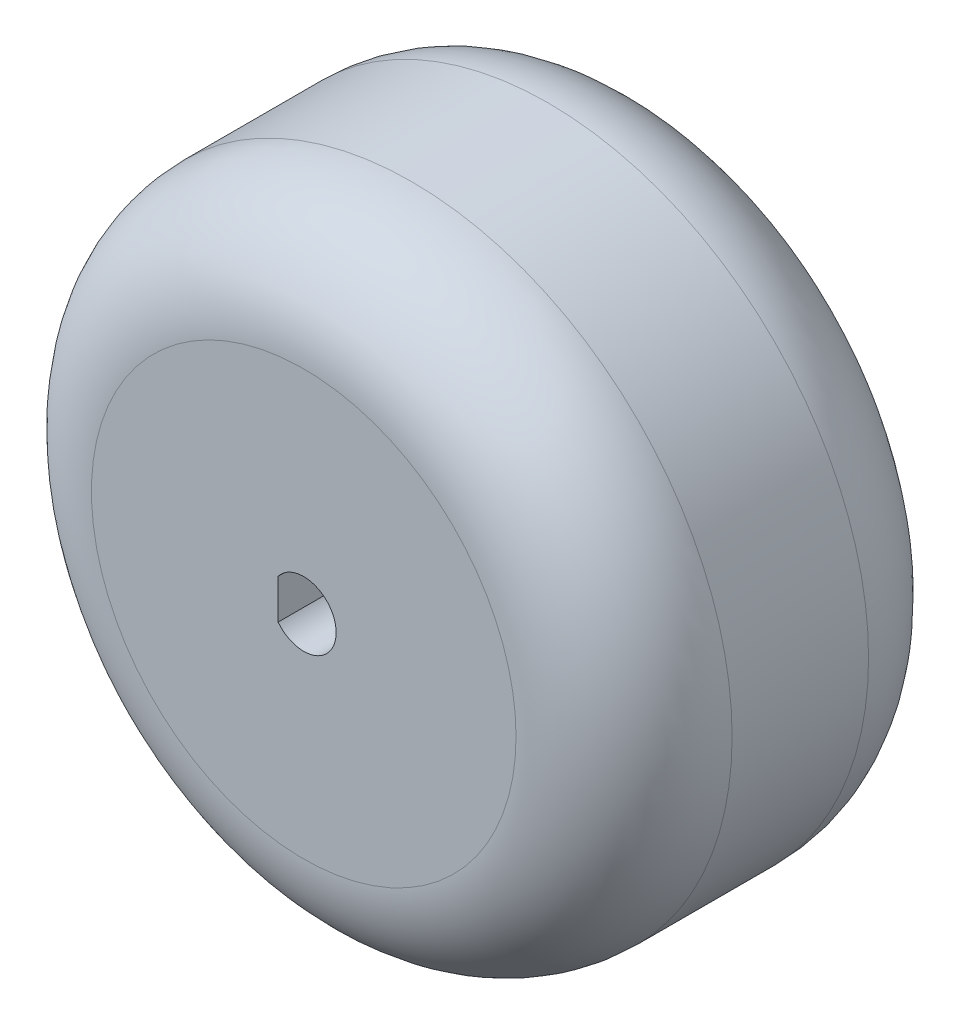
from build123d import *

# Parameters (mm, degrees)
ESQUISSE1_R             = 29.65
BOSS_EXTRU_1_DEPTH      = 32.63
ESQUISSE3_R             = 3
ENL_V_MAT_EXTRU_1_DEPTH = 33.63
ESQUISSE4_W             = 2.697553301
ESQUISSE4_H             = 5.967314877
BOSS_EXTRU_4_DEPTH      = 32.63
CONG_1_R                = 10
CONG_2_R                = 10


with BuildPart() as part:
    # Esquisse1 → Boss.-Extru.1 (new body)
    with BuildSketch(Plane.XY):
        with Locations((-8.87201182, 11.161610959)):
            Circle(ESQUISSE1_R)
    extrude(amount=BOSS_EXTRU_1_DEPTH)

    # Esquisse3 → Enlèv. mat.-Extru.1 (cut)
    with BuildSketch(Plane.XY.offset(32.63)):
        with Locations((-8.87201182, 11.161610959)):
            Circle(ESQUISSE3_R)
    extrude(amount=-ENL_V_MAT_EXTRU_1_DEPTH, mode=Mode.SUBTRACT)

    # Esquisse4 → Boss.-Extru.4 (add)
    with BuildSketch(Plane.XY.offset(32.63)):
        with Locations((-12.590788471, 11.037032126)):
            Rectangle(ESQUISSE4_W, ESQUISSE4_H)
    extrude(amount=-BOSS_EXTRU_4_DEPTH)

    # Congé1
    cong_1_edges = [part.edges().sort_by_distance(p)[0] for p in [
        (-38.52201182, 11.161610959, 0),
    ]]
    fillet(cong_1_edges, radius=CONG_1_R)

    # Congé2
    cong_2_edges = [part.edges().sort_by_distance(p)[0] for p in [
        (-38.52201182, 11.161610959, 32.63),
    ]]
    fillet(cong_2_edges, radius=CONG_2_R)


solid = part.part
